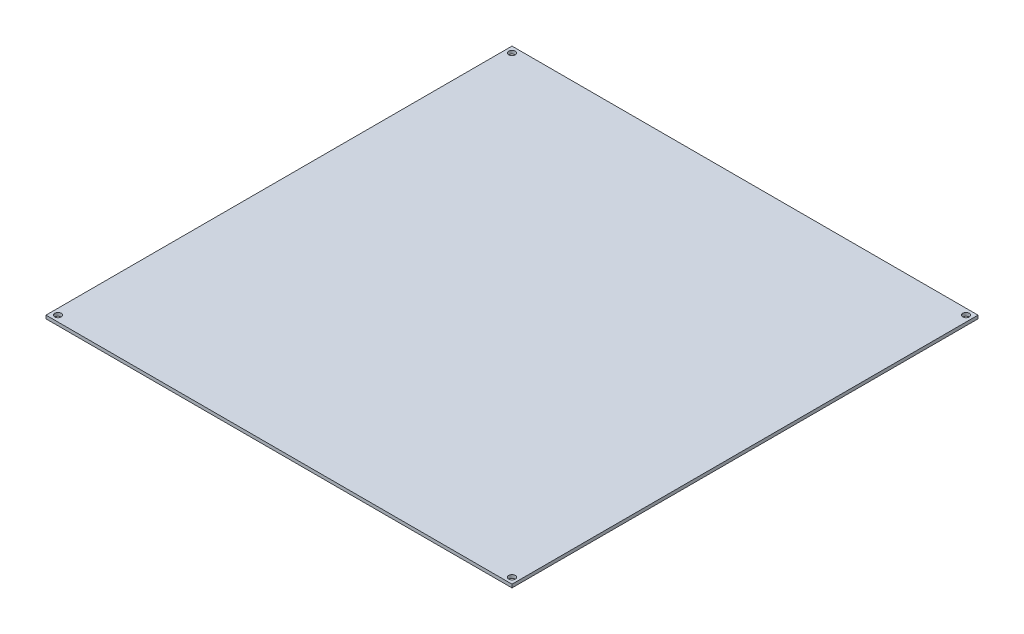
from build123d import *

# Parameters (mm, degrees)
ESBO_O1_W                = 214
ESBO_O1_H                = 214
ESBO_O1_R                = 1.5
RESSALTO_EXTRUS_O1_DEPTH = 0.75


with BuildPart() as part:
    # Esboço1 → Ressalto-extrusão1 (new, symmetric)
    with BuildSketch(Plane(origin=(0, 0, 0), x_dir=(1, 0, 0), z_dir=(0, 1, 0))):
        Rectangle(ESBO_O1_W, ESBO_O1_H)
        with Locations(Location((104.25, 104.25, 0), (0, 0, 270))):
            Circle(ESBO_O1_R, mode=Mode.SUBTRACT)
        with Locations(Location((-104.25, 104.25, 0), (0, 0, 90))):
            Circle(ESBO_O1_R, mode=Mode.SUBTRACT)
        with Locations(Location((104.25, -104.25, 0), (0, 0, 90))):
            Circle(ESBO_O1_R, mode=Mode.SUBTRACT)
        with Locations(Location((-104.25, -104.25, 0), (0, 0, 270))):
            Circle(ESBO_O1_R, mode=Mode.SUBTRACT)
    extrude(amount=RESSALTO_EXTRUS_O1_DEPTH, both=True)


solid = part.part
